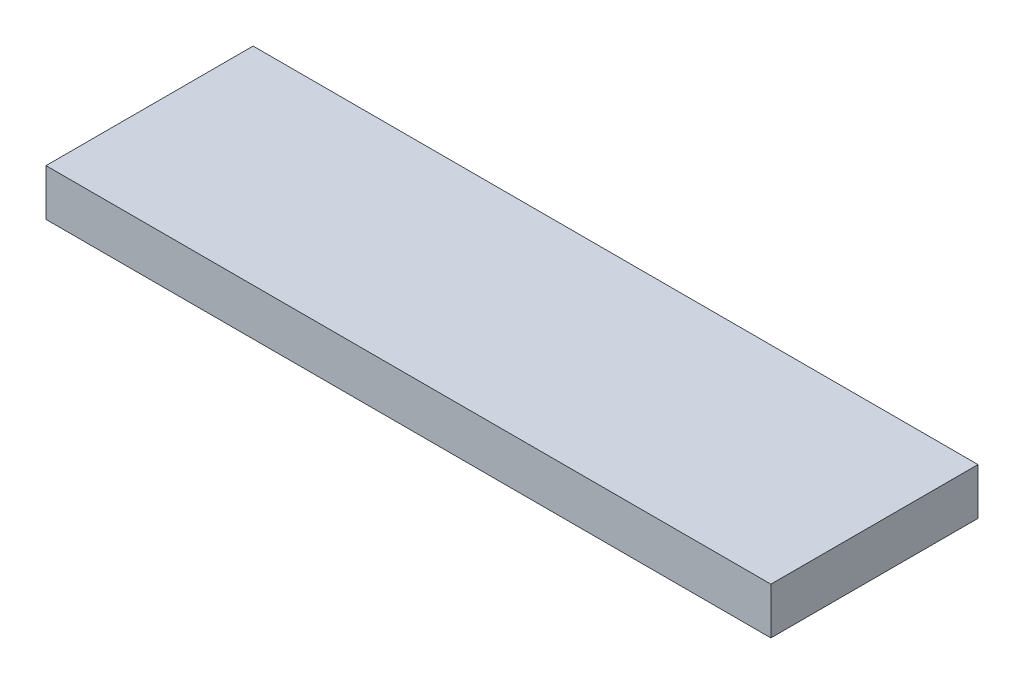
from build123d import *

# Parameters (mm, degrees)
SKETCH1_W           = 70
SKETCH1_H           = 20
BOSS_EXTRUDE1_DEPTH = 4.5


with BuildPart() as part:
    # Sketch1 → Boss-Extrude1 (new body)
    with BuildSketch(Plane(origin=(0, 0, 0), x_dir=(1, 0, 0), z_dir=(0, 1, 0))):
        Rectangle(SKETCH1_W, SKETCH1_H)
    extrude(amount=BOSS_EXTRUDE1_DEPTH)


solid = part.part
